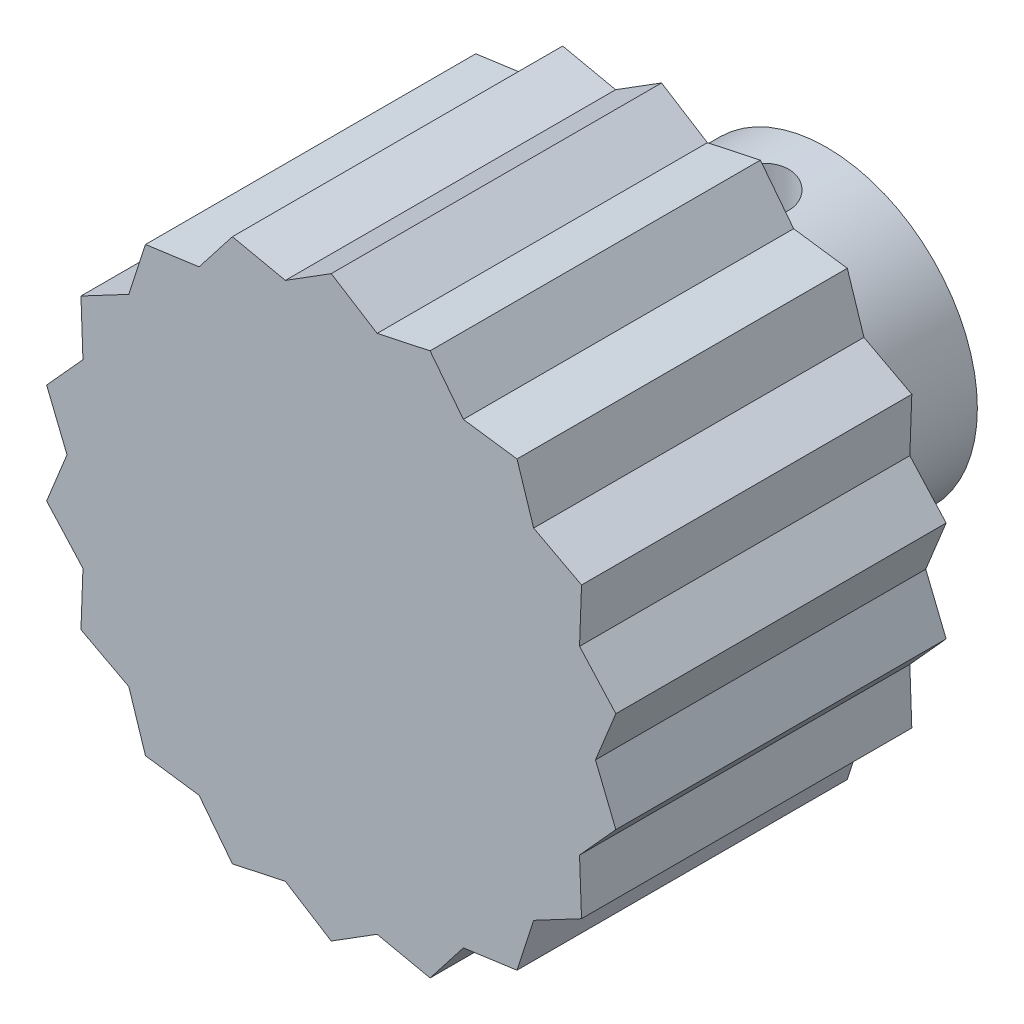
from build123d import *

# Parameters (mm, degrees)
CROQUIS1_R                 = 17.5
SALIENTE_EXTRUIR1_DEPTH    = 20
CROQUIS2_R                 = 9.125
CROQUIS2_R_2               = 4.125
SALIENTE_EXTRUIR2_DEPTH    = 10
CORTAR_EXTRUIR1_START      = -20
CROQUIS3_R                 = 19
CORTAR_EXTRUIR1_DEPTH      = 20
CORTAR_EXTRUIR2_DEPTH      = 32.674365543
CORTAR_EXTRUIR2_DEPTH_BACK = 32.674365543
CROQUIS4_R                 = 1.95
CORTAR_EXTRUIR3_START      = -5
CROQUIS5_R                 = 4.125
CORTAR_EXTRUIR3_DEPTH      = 5


with BuildPart() as part:
    # Croquis1 → Saliente-Extruir1 (new body)
    with BuildSketch(Plane.XY):
        Circle(CROQUIS1_R)
    extrude(amount=SALIENTE_EXTRUIR1_DEPTH)

    # Croquis2 → Saliente-Extruir2 (add)
    with BuildSketch(Plane(origin=(0, 0, 0), x_dir=(-1, 0, 0), z_dir=(0, 0, -1))):
        with Locations(Location((0, 0, 0), (0, 0, 180))):
            Circle(CROQUIS2_R)
        Circle(CROQUIS2_R_2, mode=Mode.SUBTRACT)
    extrude(amount=SALIENTE_EXTRUIR2_DEPTH)

    # Croquis3 → Cortar-Extruir1 (cut)
    with BuildSketch(Plane.XY.offset(20).offset(CORTAR_EXTRUIR1_START)):
        Circle(CROQUIS3_R)
        Polygon((0, 17.5), (2.778370843, 15.756924048), (5.985352508, 16.444620864), (8, 13.856406461), (11.24878317, 13.405777755), (12.25671109, 10.284601755), (15.155444566, 8.75), (15.035081933, 5.472322293), (17.234135678, 3.038843109), (16, 0), (17.234135678, -3.038843109), (15.035081933, -5.472322293), (15.155444566, -8.75), (12.25671109, -10.284601755), (11.24878317, -13.405777755), (8, -13.856406461), (5.985352508, -16.444620864), (2.778370843, -15.756924048), (0, -17.5), (-2.778370843, -15.756924048), (-5.985352508, -16.444620864), (-8, -13.856406461), (-11.24878317, -13.405777755), (-12.25671109, -10.284601755), (-15.155444566, -8.75), (-15.035081933, -5.472322293), (-17.234135678, -3.038843109), (-16, 0), (-17.234135678, 3.038843109), (-15.035081933, 5.472322293), (-15.155444566, 8.75), (-12.25671109, 10.284601755), (-11.24878317, 13.405777755), (-8, 13.856406461), (-5.985352508, 16.444620864), (-2.778370843, 15.756924048), align=None, mode=Mode.SUBTRACT)
    extrude(amount=CORTAR_EXTRUIR1_DEPTH, mode=Mode.SUBTRACT)

    # Croquis4 → Cortar-Extruir2 (cut, two sides: drawn at the far end of the back side and taken through both)
    with BuildSketch(Plane(origin=(0, 0, 0), x_dir=(1, 0, 0), z_dir=(0, 1, 0)).offset(-CORTAR_EXTRUIR2_DEPTH_BACK)):
        with Locations(Location((0, 5.75, 0), (0, 0, 270))):
            Circle(CROQUIS4_R)
    extrude(amount=CORTAR_EXTRUIR2_DEPTH + CORTAR_EXTRUIR2_DEPTH_BACK, mode=Mode.SUBTRACT)

    # Croquis5 → Cortar-Extruir3 (cut)
    with BuildSketch(Plane(origin=(0, 0, 0), x_dir=(-1, 0, 0), z_dir=(0, 0, -1)).offset(CORTAR_EXTRUIR3_START)):
        Circle(CROQUIS5_R)
    extrude(amount=CORTAR_EXTRUIR3_DEPTH, mode=Mode.SUBTRACT)


solid = part.part
